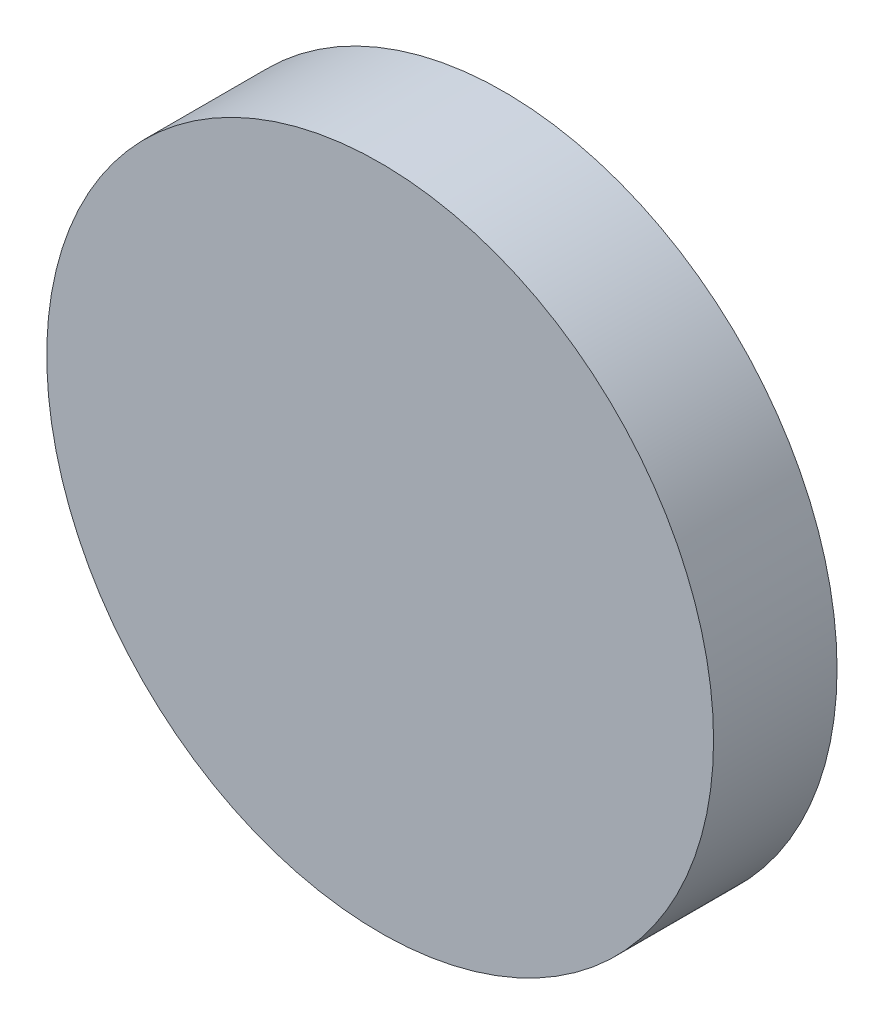
from build123d import *

# Parameters (mm, degrees)
SKETCH1_R           = 27
BOSS_EXTRUDE1_DEPTH = 5
SKETCH2_R           = 10
BOSS_EXTRUDE2_DEPTH = 2.5
CUT_EXTRUDE1_DEPTH  = 9


with BuildPart() as part:
    # Sketch1 → Boss-Extrude1 (new, symmetric)
    with BuildSketch(Plane.XY):
        Circle(SKETCH1_R)
    extrude(amount=BOSS_EXTRUDE1_DEPTH, both=True)

    # Sketch2 → Boss-Extrude2 (add)
    with BuildSketch(Plane(origin=(0, 0, -5), x_dir=(-1, 0, 0), z_dir=(0, 0, -1))):
        Circle(SKETCH2_R)
    extrude(amount=BOSS_EXTRUDE2_DEPTH)

    # Sketch3 → Cut-Extrude1 (cut)
    with BuildSketch(Plane(origin=(0, 0, -7.5), x_dir=(-1, 0, 0), z_dir=(0, 0, -1))):
        with BuildLine():
            Line((-1.953362486, -1.9), (1.953362486, -1.9))
            ThreePointArc((1.953362486, -1.9), (2.725, 0), (1.953362486, 1.9))
            Line((1.953362486, 1.9), (-1.953362486, 1.9))
            ThreePointArc((-1.953362486, 1.9), (-2.725, 0), (-1.953362486, -1.9))
        make_face()
    extrude(amount=-CUT_EXTRUDE1_DEPTH, mode=Mode.SUBTRACT)


solid = part.part
